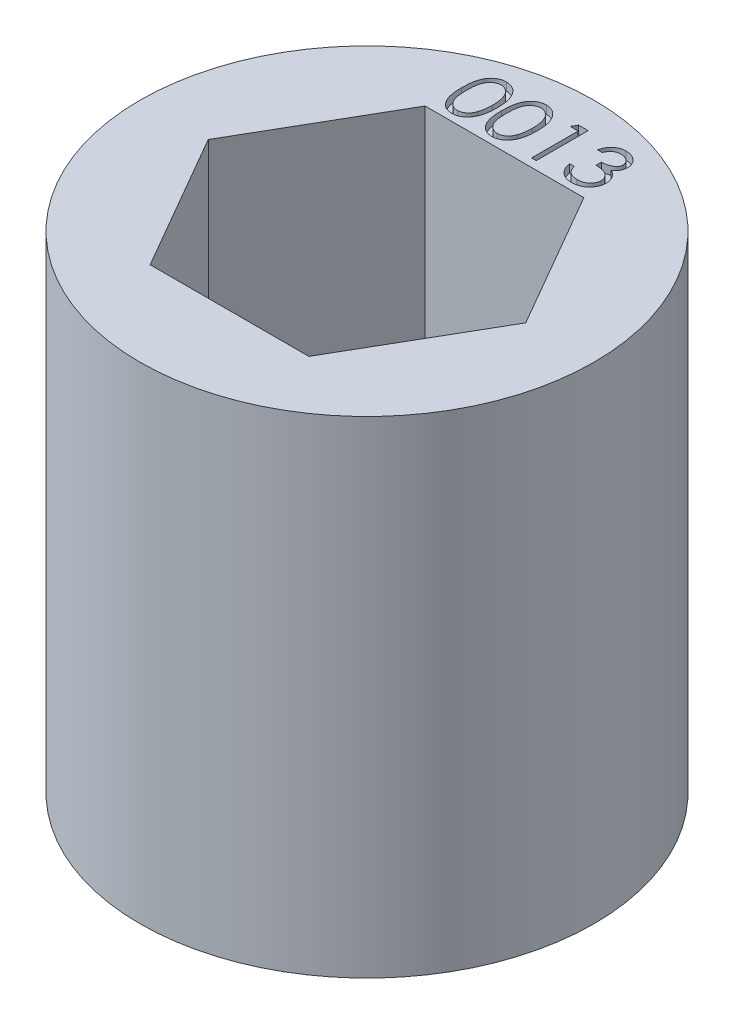
from build123d import *

# Parameters (mm, degrees)
SKETCH1_R           = 11.1125
BOSS_EXTRUDE1_DEPTH = 23.8125
CUT_EXTRUDE1_DEPTH  = 0.4


with BuildPart() as part:
    # Sketch1 → Boss-Extrude1 (new body)
    with BuildSketch(Plane(origin=(0, 0, 0), x_dir=(1, 0, 0), z_dir=(0, 1, 0))):
        with Locations(Location((0, 0, 0), (0, 0, 270))):
            Circle(SKETCH1_R)
        Polygon((7.772289324, 0), (3.886144662, 6.731), (-3.886144662, 6.731), (-7.772289324, 0), (-3.886144662, -6.731), (3.886144662, -6.731), align=None, mode=Mode.SUBTRACT)
    extrude(amount=BOSS_EXTRUDE1_DEPTH)

    # Sketch2 → Cut-Extrude1 (cut)
    # profile 1 of 4: a face of its own
    with BuildSketch(Plane(origin=(0, 23.8125, 0), x_dir=(1, 0, 0), z_dir=(0, 1, 0))):
        with BuildLine():
            add(Edge.make_bspline(
                [(-3.767489019, 8.406382372), (-3.767250971, 8.447093047), (-3.766788561, 8.526174122), (-3.761644392, 8.641406405), (-3.753098858, 8.749509015), (-3.741387736, 8.850487125), (-3.727136173, 8.944366806), (-3.70811122, 9.030897173), (-3.686475643, 9.110478716), (-3.66140044, 9.183370945), (-3.633106444, 9.250555907), (-3.602311295, 9.31327591), (-3.567792844, 9.371436055), (-3.531523885, 9.425964623), (-3.492036267, 9.475969019), (-3.450453716, 9.522155408), (-3.405153269, 9.563456353), (-3.357674857, 9.601081955), (-3.307588623, 9.634065286), (-3.256322231, 9.663117616), (-3.203522811, 9.687936948), (-3.14904621, 9.707451722), (-3.093382068, 9.723570451), (-3.036335797, 9.734593287), (-2.977813207, 9.741528872), (-2.938311537, 9.742191934), (-2.918278282, 9.742528205)],
                knots=[0, 0, 0, 0, 1.646270934, 3.197905019, 4.663502075, 6.030701355, 7.308322542, 8.50163776, 9.611534131, 10.641858119, 11.616356847, 12.558055219, 13.465016945, 14.349605745, 15.204443733, 16.039544428, 16.859896111, 17.680448484, 18.487036065, 19.28249412, 20.06191084, 20.843045899, 21.620316918, 22.403196591, 23.190181807, 24, 24, 24, 24], degree=3))
            add(Edge.make_bspline(
                [(-2.918278282, 9.742528205), (-2.898077677, 9.742174191), (-2.857905031, 9.741470167), (-2.798512301, 9.734703649), (-2.740491675, 9.723476034), (-2.684090512, 9.70756767), (-2.628845521, 9.687831379), (-2.575188814, 9.663093871), (-2.522787103, 9.63429835), (-2.472473123, 9.600462736), (-2.423694517, 9.562738456), (-2.377649424, 9.520093547), (-2.334333653, 9.472958608), (-2.293203574, 9.421837941), (-2.255426083, 9.365751051), (-2.219449935, 9.30567344), (-2.187248515, 9.24055447), (-2.156235351, 9.171480644), (-2.129465938, 9.096540732), (-2.105324148, 9.016157163), (-2.085817697, 8.929380467), (-2.069569482, 8.836665935), (-2.056982043, 8.737673076), (-2.047814354, 8.632614092), (-2.042971601, 8.521419866), (-2.042059595, 8.445395598), (-2.041591583, 8.406382372)],
                knots=[0, 0, 0, 0, 0.810914788, 1.612654377, 2.396697861, 3.181598691, 3.963628158, 4.749916497, 5.551656086, 6.361998678, 7.18212741, 8.025565596, 8.878627764, 9.750805457, 10.657531673, 11.591944965, 12.560506719, 13.57287815, 14.630710178, 15.753379473, 16.941251878, 18.199788006, 19.531962791, 20.947069417, 22.433333509, 24, 24, 24, 24], degree=3))
            add(Edge.make_bspline(
                [(-2.041591583, 8.406382372), (-2.042064447, 8.367539307), (-2.042985804, 8.29185518), (-2.047760065, 8.181161272), (-2.057164329, 8.076659835), (-2.068928149, 7.978100242), (-2.085221134, 7.885892713), (-2.105254597, 7.79971817), (-2.127497974, 7.719204473), (-2.154955225, 7.645011209), (-2.185007569, 7.576103388), (-2.217704768, 7.511756371), (-2.252734871, 7.451401405), (-2.290899274, 7.395521588), (-2.331578037, 7.343721077), (-2.375641804, 7.296914231), (-2.421848457, 7.253973229), (-2.47077061, 7.215763191), (-2.521869279, 7.18231879), (-2.574091009, 7.15240931), (-2.628362378, 7.128291868), (-2.683453493, 7.107583581), (-2.740152364, 7.091762682), (-2.798388316, 7.08082337), (-2.857865127, 7.073151228), (-2.898070835, 7.072565954), (-2.918278282, 7.072271795)],
                knots=[0, 0, 0, 0, 1.561518951, 3.042555995, 4.452378317, 5.7783523, 7.031515105, 8.214008947, 9.334062868, 10.386615937, 11.391082383, 12.354592575, 13.286541444, 14.194233754, 15.072674879, 15.931287219, 16.775624067, 17.606195743, 18.42308326, 19.229000347, 20.022332153, 20.807536673, 21.593273796, 22.3848459, 23.188221202, 24, 24, 24, 24], degree=3))
            add(Edge.make_bspline(
                [(-2.918278282, 7.072271795), (-2.938310981, 7.072610236), (-2.977811555, 7.073277575), (-3.036342173, 7.080181826), (-3.09315286, 7.091281991), (-3.148523956, 7.106824327), (-3.202739541, 7.125848808), (-3.255060846, 7.150634624), (-3.306069623, 7.17917992), (-3.35562978, 7.211688597), (-3.402810034, 7.248933475), (-3.447875879, 7.290128131), (-3.489695179, 7.336300549), (-3.528618208, 7.386721671), (-3.565610832, 7.440927624), (-3.59963912, 7.4996585), (-3.631113969, 7.562681423), (-3.659883816, 7.630403564), (-3.685391704, 7.70381314), (-3.707923469, 7.783749972), (-3.725713743, 7.870919606), (-3.740941374, 7.964621923), (-3.75322364, 8.065259576), (-3.761608779, 8.172887198), (-3.766791333, 8.287437721), (-3.767252213, 8.366010643), (-3.767489019, 8.406382372)],
                knots=[0, 0, 0, 0, 0.810891512, 1.598919785, 2.382837074, 3.152667961, 3.926044502, 4.706494248, 5.493654104, 6.291793342, 7.103789334, 7.925228297, 8.761435821, 9.622817696, 10.50288917, 11.416980706, 12.369136599, 13.353924996, 14.394355917, 15.514179734, 16.714354668, 17.994756427, 19.357759367, 20.818452758, 22.365282078, 24, 24, 24, 24], degree=3))
        make_face()
        with BuildLine():
            add(Edge.make_bspline(
                [(-3.539540301, 8.4074), (-3.539453616, 8.373473801), (-3.539285379, 8.307629712), (-3.534890308, 8.211949174), (-3.528902996, 8.122707849), (-3.521180455, 8.039792426), (-3.509712029, 7.96348356), (-3.496861961, 7.893256418), (-3.481224204, 7.829482652), (-3.462722105, 7.771724641), (-3.441648018, 7.719002174), (-3.41863862, 7.669943006), (-3.393920267, 7.623967601), (-3.366256654, 7.581488925), (-3.33612858, 7.542368452), (-3.304216558, 7.505913768), (-3.269329596, 7.473403958), (-3.22106688, 7.434413612), (-3.157351725, 7.394122584), (-3.07707288, 7.359037136), (-2.994582061, 7.336988153), (-2.938592297, 7.33418417), (-2.91064607, 7.332784615)],
                knots=[0, 0, 0, 0, 1.459021318, 2.831673884, 4.118529203, 5.306027144, 6.411944654, 7.436330062, 8.375795394, 9.233974572, 10.042671642, 10.816086306, 11.563610507, 12.285937304, 12.993564865, 13.685989202, 14.367179055, 15.041617293, 16.353048772, 17.594441528, 18.799311195, 20, 20, 20, 20], degree=3))
            add(Edge.make_bspline(
                [(-2.91064607, 7.332784615), (-2.882519074, 7.333944148), (-2.826323154, 7.336260818), (-2.744220342, 7.358611902), (-2.664514946, 7.392335511), (-2.60205131, 7.4322117), (-2.554529692, 7.470187117), (-2.520481362, 7.502564604), (-2.489230619, 7.538818291), (-2.459590942, 7.57793378), (-2.432406355, 7.620658383), (-2.40768625, 7.666786652), (-2.38512862, 7.716446684), (-2.372276913, 7.751113866), (-2.365706166, 7.768838301)],
                knots=[0, 0, 0, 0, 1.353760809, 2.704726607, 4.075137775, 5.516104923, 6.260822281, 7.007110065, 7.778089737, 8.566572457, 9.372053459, 10.217411131, 11.088608312, 12, 12, 12, 12], degree=3))
            add(Edge.make_bspline(
                [(-2.365706166, 7.768838301), (-2.358048598, 7.791502169), (-2.342500449, 7.837519541), (-2.32246219, 7.908903449), (-2.306681243, 7.983799169), (-2.292483829, 8.061759111), (-2.282793326, 8.143358208), (-2.274993484, 8.228343984), (-2.270399214, 8.316780515), (-2.269829709, 8.376866023), (-2.269540301, 8.4074)],
                knots=[0, 0, 0, 0, 0.884706709, 1.796334032, 2.740027952, 3.714592787, 4.726048262, 5.777819803, 6.87074269, 8, 8, 8, 8], degree=3))
            add(Edge.make_bspline(
                [(-2.269540301, 8.4074), (-2.269939581, 8.437929038), (-2.270720658, 8.497650364), (-2.273706238, 8.585112129), (-2.281415918, 8.668183018), (-2.289978707, 8.747220904), (-2.302604119, 8.821788267), (-2.316216927, 8.892509345), (-2.334505807, 8.958507998), (-2.354041872, 9.020817523), (-2.376401416, 9.078729998), (-2.401014549, 9.132515431), (-2.427301197, 9.182433489), (-2.455852423, 9.228347212), (-2.48632929, 9.270462257), (-2.519536197, 9.30793422), (-2.554155942, 9.341924477), (-2.602646128, 9.380723027), (-2.66612747, 9.420282943), (-2.745118311, 9.456688952), (-2.827320436, 9.477595542), (-2.882890886, 9.480543166), (-2.91064607, 9.482015385)],
                knots=[0, 0, 0, 0, 1.31362396, 2.569729283, 3.763502607, 4.902122613, 5.988968491, 7.01645872, 7.998833611, 8.933434873, 9.825090667, 10.667526885, 11.477055099, 12.250526234, 12.991942729, 13.710640831, 14.402115721, 15.076753259, 16.378508321, 17.609869233, 18.806226677, 20, 20, 20, 20], degree=3))
            add(Edge.make_bspline(
                [(-2.91064607, 9.482015385), (-2.9387389, 9.480541135), (-2.994975737, 9.477589949), (-3.078032253, 9.456766845), (-3.157646268, 9.420471721), (-3.220959741, 9.380592), (-3.269483746, 9.342609339), (-3.30365233, 9.309671741), (-3.335689838, 9.273642745), (-3.365202968, 9.234162499), (-3.392844905, 9.191733346), (-3.418231126, 9.1460215), (-3.441103702, 9.09679531), (-3.462210766, 9.044096525), (-3.480769303, 8.986343497), (-3.496077494, 8.922648284), (-3.510219527, 8.852644512), (-3.52023095, 8.775922354), (-3.529130933, 8.692986163), (-3.53485054, 8.603522052), (-3.539300081, 8.507681045), (-3.539458624, 8.441496512), (-3.539540301, 8.4074)],
                knots=[0, 0, 0, 0, 1.207732386, 2.417664972, 3.655092373, 4.956220595, 5.625982001, 6.301752483, 6.994047911, 7.697131622, 8.419323945, 9.170223765, 9.943494443, 10.752040957, 11.610060368, 12.549350801, 13.567764191, 14.679664412, 15.874934091, 17.154273443, 18.533957287, 20, 20, 20, 20], degree=3))
        make_face(mode=Mode.SUBTRACT)
    # profile 2 of 4: a face of its own
    with BuildSketch(Plane(origin=(0, 23.8125, 0), x_dir=(1, 0, 0), z_dir=(0, 1, 0))):
        with BuildLine():
            add(Edge.make_bspline(
                [(-1.813642865, 8.406382372), (-1.813404817, 8.447093047), (-1.812942407, 8.526174122), (-1.807798238, 8.641406405), (-1.799252704, 8.749509015), (-1.787541582, 8.850487125), (-1.773290019, 8.944366806), (-1.754265066, 9.030897173), (-1.73262949, 9.110478716), (-1.707554286, 9.183370945), (-1.679260291, 9.250555907), (-1.648465141, 9.31327591), (-1.613946691, 9.371436055), (-1.577677731, 9.425964623), (-1.538190113, 9.475969019), (-1.496607562, 9.522155408), (-1.451307115, 9.563456353), (-1.403828703, 9.601081955), (-1.353742469, 9.634065286), (-1.302476077, 9.663117616), (-1.249676658, 9.687936948), (-1.195200056, 9.707451722), (-1.139535914, 9.723570451), (-1.082489643, 9.734593287), (-1.023967053, 9.741528872), (-0.984465383, 9.742191934), (-0.964432128, 9.742528205)],
                knots=[0, 0, 0, 0, 1.646270934, 3.197905019, 4.663502075, 6.030701355, 7.308322542, 8.50163776, 9.611534131, 10.641858119, 11.616356847, 12.558055219, 13.465016945, 14.349605745, 15.204443733, 16.039544428, 16.859896111, 17.680448484, 18.487036065, 19.28249412, 20.06191084, 20.843045899, 21.620316918, 22.403196591, 23.190181807, 24, 24, 24, 24], degree=3))
            add(Edge.make_bspline(
                [(-0.964432128, 9.742528205), (-0.944231523, 9.742174191), (-0.904058877, 9.741470167), (-0.844666147, 9.734703649), (-0.786645521, 9.723476034), (-0.730244358, 9.70756767), (-0.674999368, 9.687831379), (-0.62134266, 9.663093871), (-0.56894095, 9.63429835), (-0.518626969, 9.600462736), (-0.469848363, 9.562738456), (-0.42380327, 9.520093547), (-0.380487499, 9.472958608), (-0.33935742, 9.421837941), (-0.30157993, 9.365751051), (-0.265603782, 9.30567344), (-0.233402361, 9.24055447), (-0.202389197, 9.171480644), (-0.175619784, 9.096540732), (-0.151477994, 9.016157163), (-0.131971543, 8.929380467), (-0.115723328, 8.836665935), (-0.103135889, 8.737673076), (-0.0939682, 8.632614092), (-0.089125447, 8.521419866), (-0.088213441, 8.445395598), (-0.087745429, 8.406382372)],
                knots=[0, 0, 0, 0, 0.810914788, 1.612654377, 2.396697861, 3.181598691, 3.963628158, 4.749916497, 5.551656086, 6.361998678, 7.18212741, 8.025565596, 8.878627764, 9.750805457, 10.657531673, 11.591944965, 12.560506719, 13.57287815, 14.630710178, 15.753379473, 16.941251878, 18.199788006, 19.531962791, 20.947069417, 22.433333509, 24, 24, 24, 24], degree=3))
            add(Edge.make_bspline(
                [(-0.087745429, 8.406382372), (-0.088218293, 8.367539307), (-0.08913965, 8.29185518), (-0.093913911, 8.181161272), (-0.103318175, 8.076659835), (-0.115081995, 7.978100242), (-0.13137498, 7.885892713), (-0.151408443, 7.79971817), (-0.17365182, 7.719204473), (-0.201109071, 7.645011209), (-0.231161415, 7.576103388), (-0.263858615, 7.511756371), (-0.298888717, 7.451401405), (-0.33705312, 7.395521588), (-0.377731883, 7.343721077), (-0.42179565, 7.296914231), (-0.468002303, 7.253973229), (-0.516924456, 7.215763191), (-0.568023125, 7.18231879), (-0.620244855, 7.15240931), (-0.674516225, 7.128291868), (-0.729607339, 7.107583581), (-0.78630621, 7.091762682), (-0.844542162, 7.08082337), (-0.904018974, 7.073151228), (-0.944224681, 7.072565954), (-0.964432128, 7.072271795)],
                knots=[0, 0, 0, 0, 1.561518951, 3.042555995, 4.452378317, 5.7783523, 7.031515105, 8.214008947, 9.334062868, 10.386615937, 11.391082383, 12.354592575, 13.286541444, 14.194233754, 15.072674879, 15.931287219, 16.775624067, 17.606195743, 18.42308326, 19.229000347, 20.022332153, 20.807536673, 21.593273796, 22.3848459, 23.188221202, 24, 24, 24, 24], degree=3))
            add(Edge.make_bspline(
                [(-0.964432128, 7.072271795), (-0.984464828, 7.072610236), (-1.023965402, 7.073277575), (-1.082496019, 7.080181826), (-1.139306706, 7.091281991), (-1.194677802, 7.106824327), (-1.248893387, 7.125848808), (-1.301214693, 7.150634624), (-1.352223469, 7.17917992), (-1.401783627, 7.211688597), (-1.448963881, 7.248933475), (-1.494029726, 7.290128131), (-1.535849025, 7.336300549), (-1.574772054, 7.386721671), (-1.611764678, 7.440927624), (-1.645792967, 7.4996585), (-1.677267815, 7.562681423), (-1.706037662, 7.630403564), (-1.73154555, 7.70381314), (-1.754077315, 7.783749972), (-1.771867589, 7.870919606), (-1.78709522, 7.964621923), (-1.799377486, 8.065259576), (-1.807762625, 8.172887198), (-1.81294518, 8.287437721), (-1.813406059, 8.366010643), (-1.813642865, 8.406382372)],
                knots=[0, 0, 0, 0, 0.810891512, 1.598919785, 2.382837074, 3.152667961, 3.926044502, 4.706494248, 5.493654104, 6.291793342, 7.103789334, 7.925228297, 8.761435821, 9.622817696, 10.50288917, 11.416980706, 12.369136599, 13.353924996, 14.394355917, 15.514179734, 16.714354668, 17.994756427, 19.357759367, 20.818452758, 22.365282078, 24, 24, 24, 24], degree=3))
        make_face()
        with BuildLine():
            add(Edge.make_bspline(
                [(-1.585694147, 8.4074), (-1.585607462, 8.373473801), (-1.585439225, 8.307629712), (-1.581044154, 8.211949174), (-1.575056842, 8.122707849), (-1.567334301, 8.039792426), (-1.555865876, 7.96348356), (-1.543015807, 7.893256418), (-1.52737805, 7.829482652), (-1.508875952, 7.771724641), (-1.487801864, 7.719002174), (-1.464792466, 7.669943006), (-1.440074113, 7.623967601), (-1.412410501, 7.581488925), (-1.382282426, 7.542368452), (-1.350370404, 7.505913768), (-1.315483443, 7.473403958), (-1.267220727, 7.434413612), (-1.203505571, 7.394122584), (-1.123226726, 7.359037136), (-1.040735908, 7.336988153), (-0.984746143, 7.33418417), (-0.956799916, 7.332784615)],
                knots=[0, 0, 0, 0, 1.459021318, 2.831673884, 4.118529203, 5.306027144, 6.411944654, 7.436330062, 8.375795394, 9.233974572, 10.042671642, 10.816086306, 11.563610507, 12.285937304, 12.993564865, 13.685989202, 14.367179055, 15.041617293, 16.353048772, 17.594441528, 18.799311195, 20, 20, 20, 20], degree=3))
            add(Edge.make_bspline(
                [(-0.956799916, 7.332784615), (-0.92867292, 7.333944148), (-0.872477, 7.336260818), (-0.790374189, 7.358611902), (-0.710668793, 7.392335511), (-0.648205156, 7.4322117), (-0.600683539, 7.470187117), (-0.566635209, 7.502564604), (-0.535384465, 7.538818291), (-0.505744788, 7.57793378), (-0.478560201, 7.620658383), (-0.453840096, 7.666786652), (-0.431282466, 7.716446684), (-0.418430759, 7.751113866), (-0.411860012, 7.768838301)],
                knots=[0, 0, 0, 0, 1.353760809, 2.704726607, 4.075137775, 5.516104923, 6.260822281, 7.007110065, 7.778089737, 8.566572457, 9.372053459, 10.217411131, 11.088608312, 12, 12, 12, 12], degree=3))
            add(Edge.make_bspline(
                [(-0.411860012, 7.768838301), (-0.404202444, 7.791502169), (-0.388654295, 7.837519541), (-0.368616036, 7.908903449), (-0.352835089, 7.983799169), (-0.338637675, 8.061759111), (-0.328947172, 8.143358208), (-0.32114733, 8.228343984), (-0.31655306, 8.316780515), (-0.315983555, 8.376866023), (-0.315694147, 8.4074)],
                knots=[0, 0, 0, 0, 0.884706709, 1.796334032, 2.740027952, 3.714592787, 4.726048262, 5.777819803, 6.87074269, 8, 8, 8, 8], degree=3))
            add(Edge.make_bspline(
                [(-0.315694147, 8.4074), (-0.316093427, 8.437929038), (-0.316874504, 8.497650364), (-0.319860084, 8.585112129), (-0.327569764, 8.668183018), (-0.336132553, 8.747220904), (-0.348757965, 8.821788267), (-0.362370773, 8.892509345), (-0.380659653, 8.958507998), (-0.400195718, 9.020817523), (-0.422555263, 9.078729998), (-0.447168395, 9.132515431), (-0.473455043, 9.182433489), (-0.502006269, 9.228347212), (-0.532483136, 9.270462257), (-0.565690043, 9.30793422), (-0.600309788, 9.341924477), (-0.648799975, 9.380723027), (-0.712281316, 9.420282943), (-0.791272157, 9.456688952), (-0.873474282, 9.477595542), (-0.929044732, 9.480543166), (-0.956799916, 9.482015385)],
                knots=[0, 0, 0, 0, 1.31362396, 2.569729283, 3.763502607, 4.902122613, 5.988968491, 7.01645872, 7.998833611, 8.933434873, 9.825090667, 10.667526885, 11.477055099, 12.250526234, 12.991942729, 13.710640831, 14.402115721, 15.076753259, 16.378508321, 17.609869233, 18.806226677, 20, 20, 20, 20], degree=3))
            add(Edge.make_bspline(
                [(-0.956799916, 9.482015385), (-0.984892746, 9.480541135), (-1.041129584, 9.477589949), (-1.124186099, 9.456766845), (-1.203800115, 9.420471721), (-1.267113588, 9.380592), (-1.315637593, 9.342609339), (-1.349806176, 9.309671741), (-1.381843684, 9.273642745), (-1.411356815, 9.234162499), (-1.438998752, 9.191733346), (-1.464384972, 9.1460215), (-1.487257549, 9.09679531), (-1.508364612, 9.044096525), (-1.52692315, 8.986343497), (-1.54223134, 8.922648284), (-1.556373373, 8.852644512), (-1.566384797, 8.775922354), (-1.575284779, 8.692986163), (-1.581004386, 8.603522052), (-1.585453927, 8.507681045), (-1.58561247, 8.441496512), (-1.585694147, 8.4074)],
                knots=[0, 0, 0, 0, 1.207732386, 2.417664972, 3.655092373, 4.956220595, 5.625982001, 6.301752483, 6.994047911, 7.697131622, 8.419323945, 9.170223765, 9.943494443, 10.752040957, 11.610060368, 12.549350801, 13.567764191, 14.679664412, 15.874934091, 17.154273443, 18.533957287, 20, 20, 20, 20], degree=3))
        make_face(mode=Mode.SUBTRACT)
    # profile 3 of 4: a face of its own
    with BuildSketch(Plane(origin=(0, 23.8125, 0), x_dir=(1, 0, 0), z_dir=(0, 1, 0))):
        Polygon((0.680055052, 9.6774), (1.149690468, 9.6774), (1.149690468, 7.1374), (0.921741751, 7.1374), (0.921741751, 9.416887179), (0.53097252, 9.416887179), align=None)
    # profile 4 of 4: a face of its own
    with BuildSketch(Plane(origin=(0, 23.8125, 0), x_dir=(1, 0, 0), z_dir=(0, 1, 0))):
        with BuildLine():
            Line((2.419690468, 9.091246154), (2.191741751, 9.091246154))
            add(Edge.make_bspline(
                [(2.191741751, 9.091246154), (2.197917253, 9.116814871), (2.209989855, 9.166799621), (2.23517038, 9.238215176), (2.26260184, 9.305796246), (2.295541361, 9.368277397), (2.331470571, 9.426914314), (2.372635061, 9.480377051), (2.417135659, 9.530025317), (2.466357194, 9.574085781), (2.51797628, 9.613983904), (2.572720261, 9.648001803), (2.629487732, 9.677265617), (2.688672006, 9.701374014), (2.750449285, 9.719535394), (2.814261069, 9.732712047), (2.88027458, 9.741269027), (2.925085689, 9.742104152), (2.947839507, 9.742528205)],
                knots=[0, 0, 0, 0, 1.162005537, 2.271625781, 3.343758855, 4.383309926, 5.390229558, 6.379919256, 7.361854164, 8.333198761, 9.295911338, 10.242430842, 11.177959212, 12.116337295, 13.062827104, 14.020064771, 14.994644689, 16, 16, 16, 16], degree=3))
            add(Edge.make_bspline(
                [(2.947839507, 9.742528205), (2.980992125, 9.741527278), (3.046574208, 9.739547257), (3.142922247, 9.721466495), (3.235833139, 9.692855113), (3.324289907, 9.653322751), (3.406454141, 9.604563958), (3.479559831, 9.546532406), (3.542616065, 9.48034777), (3.595516556, 9.407244709), (3.636936698, 9.329117568), (3.667479381, 9.248708311), (3.686073401, 9.16620768), (3.688483176, 9.110503826), (3.689690468, 9.082596314)],
                knots=[0, 0, 0, 0, 1.083050992, 2.142477498, 3.193116406, 4.255571735, 5.30263384, 6.308962982, 7.297363603, 8.282367274, 9.249857812, 10.179914175, 11.08814088, 12, 12, 12, 12], degree=3))
            add(Edge.make_bspline(
                [(3.689690468, 9.082596314), (3.688846034, 9.055739955), (3.687193606, 9.003186226), (3.67316286, 8.926462626), (3.649550829, 8.854151293), (3.616843059, 8.785947821), (3.574503762, 8.722284651), (3.523215576, 8.663018548), (3.462616502, 8.607886644), (3.416694073, 8.576303941), (3.393051847, 8.560044231)],
                knots=[0, 0, 0, 0, 1.024540389, 2.004866551, 2.965041327, 3.920577974, 4.882998113, 5.874504559, 6.905732034, 8, 8, 8, 8], degree=3))
            add(Edge.make_bspline(
                [(3.393051847, 8.560044231), (3.420071463, 8.546997215), (3.473605137, 8.521147303), (3.546576093, 8.470451982), (3.612817751, 8.411918518), (3.649759307, 8.366240136), (3.668320276, 8.343289423)],
                knots=[0, 0, 0, 0, 1.015518401, 2.012035669, 3.001164323, 4, 4, 4, 4], degree=3))
            add(Edge.make_bspline(
                [(3.668320276, 8.343289423), (3.680542279, 8.326556083), (3.704786141, 8.293363424), (3.734711357, 8.239996989), (3.761859685, 8.186039051), (3.783014416, 8.130043368), (3.799396593, 8.072658952), (3.811106743, 8.013787271), (3.818381405, 7.953380249), (3.819423205, 7.912513477), (3.819946879, 7.891971314)],
                knots=[0, 0, 0, 0, 1.025084078, 2.033381695, 3.024893161, 4.013698104, 4.991890475, 5.976764909, 6.982997093, 8, 8, 8, 8], degree=3))
            add(Edge.make_bspline(
                [(3.819946879, 7.891971314), (3.818644575, 7.856404259), (3.816046095, 7.785437529), (3.792820281, 7.680590159), (3.756815244, 7.578100795), (3.705683639, 7.480075054), (3.643368361, 7.388359006), (3.569231331, 7.306297914), (3.484114909, 7.235759498), (3.389187381, 7.176824075), (3.286341237, 7.129712212), (3.176340664, 7.097013382), (3.060770625, 7.075716571), (2.981517329, 7.073432843), (2.941224924, 7.072271795)],
                knots=[0, 0, 0, 0, 0.955779014, 1.907060117, 2.875433937, 3.871313158, 4.872415639, 5.851225146, 6.836215519, 7.83643374, 8.849228613, 9.86973379, 10.916971861, 12, 12, 12, 12], degree=3))
            add(Edge.make_bspline(
                [(2.941224924, 7.072271795), (2.914069203, 7.07290187), (2.8606358, 7.074141647), (2.782081947, 7.082616974), (2.707099913, 7.098096464), (2.635588319, 7.118926863), (2.567483636, 7.14533687), (2.502993685, 7.178225296), (2.441721705, 7.216914215), (2.384245895, 7.261860304), (2.330573106, 7.312138762), (2.2821297, 7.368642158), (2.238108022, 7.430325988), (2.199686793, 7.497906721), (2.165115976, 7.570510993), (2.136681796, 7.649068475), (2.111655126, 7.732876879), (2.100019412, 7.791280725), (2.094049443, 7.821246154)],
                knots=[0, 0, 0, 0, 1.048658725, 2.063410685, 3.046034179, 4.001477787, 4.936774919, 5.862367409, 6.792675028, 7.730719943, 8.675894397, 9.627829632, 10.600096036, 11.597688215, 12.626045268, 13.701542398, 14.82072376, 16, 16, 16, 16], degree=3))
            Line((2.094049443, 7.821246154), (2.321998161, 7.821246154))
            add(Edge.make_bspline(
                [(2.321998161, 7.821246154), (2.327936892, 7.80168887), (2.339488241, 7.763648254), (2.35915096, 7.708900146), (2.381552506, 7.658711159), (2.405584214, 7.612713122), (2.430823429, 7.570453036), (2.459064547, 7.533048365), (2.488215869, 7.49885619), (2.510190028, 7.479592386), (2.520944475, 7.470164423)],
                knots=[0, 0, 0, 0, 1.198163088, 2.33053128, 3.407730985, 4.417276592, 5.372219308, 6.28897303, 7.162600585, 8, 8, 8, 8], degree=3))
            add(Edge.make_bspline(
                [(2.520944475, 7.470164423), (2.53516599, 7.459200089), (2.563565123, 7.437305266), (2.609842639, 7.409364084), (2.658512585, 7.385153512), (2.71062952, 7.36665963), (2.765068811, 7.351000413), (2.822710384, 7.340752951), (2.883045702, 7.333722106), (2.924242879, 7.33310167), (2.945295436, 7.332784615)],
                knots=[0, 0, 0, 0, 0.946170439, 1.889420265, 2.845303464, 3.807233317, 4.801018734, 5.828864929, 6.890507805, 8, 8, 8, 8], degree=3))
            add(Edge.make_bspline(
                [(2.945295436, 7.332784615), (2.969065121, 7.333231587), (3.015544688, 7.3341056), (3.083366214, 7.342143399), (3.147887619, 7.35384947), (3.208392542, 7.371929178), (3.265673539, 7.394267282), (3.318927651, 7.422314982), (3.368853968, 7.455222294), (3.414813022, 7.492624998), (3.45613919, 7.533570883), (3.492526151, 7.576397511), (3.523459477, 7.620924313), (3.548412131, 7.667397692), (3.568115673, 7.715625201), (3.581529196, 7.76574218), (3.590855724, 7.817338482), (3.591615265, 7.852411505), (3.591998161, 7.870092308)],
                knots=[0, 0, 0, 0, 1.217147791, 2.380027433, 3.494444702, 4.572153297, 5.609568379, 6.639424714, 7.649109417, 8.668170816, 9.669597737, 10.625200337, 11.543417969, 12.441394052, 13.322311151, 14.205496177, 15.095365482, 16, 16, 16, 16], degree=3))
            add(Edge.make_bspline(
                [(3.591998161, 7.870092308), (3.590887599, 7.893758822), (3.588672002, 7.94097409), (3.571756633, 8.010437701), (3.543933571, 8.077365549), (3.504982663, 8.140615751), (3.457567591, 8.199235976), (3.402148488, 8.251539281), (3.338265145, 8.294697576), (3.279467868, 8.3245162), (3.227386869, 8.344863106), (3.182816847, 8.358415795), (3.132919198, 8.369891991), (3.078297333, 8.380568896), (3.018539685, 8.389655818), (2.95371131, 8.397233592), (2.883799071, 8.403296965), (2.835400339, 8.406004674), (2.810459699, 8.4074)],
                knots=[0, 0, 0, 0, 1.07054697, 2.135767047, 3.216561865, 4.33974944, 5.486079747, 6.621378074, 7.775625952, 8.963672916, 9.598146892, 10.304877434, 11.070270905, 11.915000392, 12.823868403, 13.805723172, 14.86925407, 16, 16, 16, 16], degree=3))
            Line((2.810459699, 8.4074), (2.810459699, 8.667912821))
            add(Edge.make_bspline(
                [(2.810459699, 8.667912821), (2.841883974, 8.668446078), (2.903436408, 8.669490599), (2.993348275, 8.68212384), (3.07932605, 8.699599496), (3.159464314, 8.726367607), (3.232506523, 8.757457423), (3.295875606, 8.793635883), (3.348683764, 8.833851158), (3.390674371, 8.878723966), (3.422264154, 8.926849744), (3.445361315, 8.97700869), (3.459004981, 9.029640437), (3.460826282, 9.065559424), (3.461741751, 9.083613942)],
                knots=[0, 0, 0, 0, 1.321986639, 2.589447074, 3.816329219, 5.01088745, 6.139805852, 7.153945165, 8.075214402, 8.924034688, 9.728124013, 10.488707548, 11.240355623, 12, 12, 12, 12], degree=3))
            add(Edge.make_bspline(
                [(3.461741751, 9.083613942), (3.461441007, 9.096878363), (3.460842691, 9.123267299), (3.453297238, 9.16182092), (3.441958648, 9.199195893), (3.426370502, 9.235233275), (3.405506072, 9.269683131), (3.380537156, 9.302839165), (3.35080602, 9.334512079), (3.316737039, 9.364034368), (3.280152472, 9.392169757), (3.24005692, 9.416055654), (3.197659331, 9.436480928), (3.152912765, 9.453324395), (3.105672008, 9.46599485), (3.056159021, 9.475092289), (3.004279388, 9.480780187), (2.968885045, 9.481599094), (2.950892392, 9.482015385)],
                knots=[0, 0, 0, 0, 0.884392785, 1.759457502, 2.611959086, 3.489218968, 4.37281399, 5.2945488, 6.255912374, 7.266815255, 8.301784654, 9.332968512, 10.37626691, 11.440494194, 12.520033166, 13.637162961, 14.798855837, 16, 16, 16, 16], degree=3))
            add(Edge.make_bspline(
                [(2.950892392, 9.482015385), (2.921971467, 9.481005653), (2.865482174, 9.479033413), (2.784046206, 9.461759226), (2.708340175, 9.434197989), (2.650472686, 9.401299169), (2.60774076, 9.36882314), (2.577204925, 9.340460494), (2.54721804, 9.308940673), (2.519752892, 9.272322309), (2.49197692, 9.233085267), (2.466689724, 9.189234938), (2.442117262, 9.141915178), (2.42731084, 9.108462917), (2.419690468, 9.091246154)],
                knots=[0, 0, 0, 0, 1.472543308, 2.876219568, 4.221790263, 5.565193594, 6.249813518, 6.953379497, 7.687249741, 8.463570142, 9.283606569, 10.136032583, 11.040678096, 12, 12, 12, 12], degree=3))
        make_face()
    extrude(amount=-CUT_EXTRUDE1_DEPTH, mode=Mode.SUBTRACT)


solid = part.part
